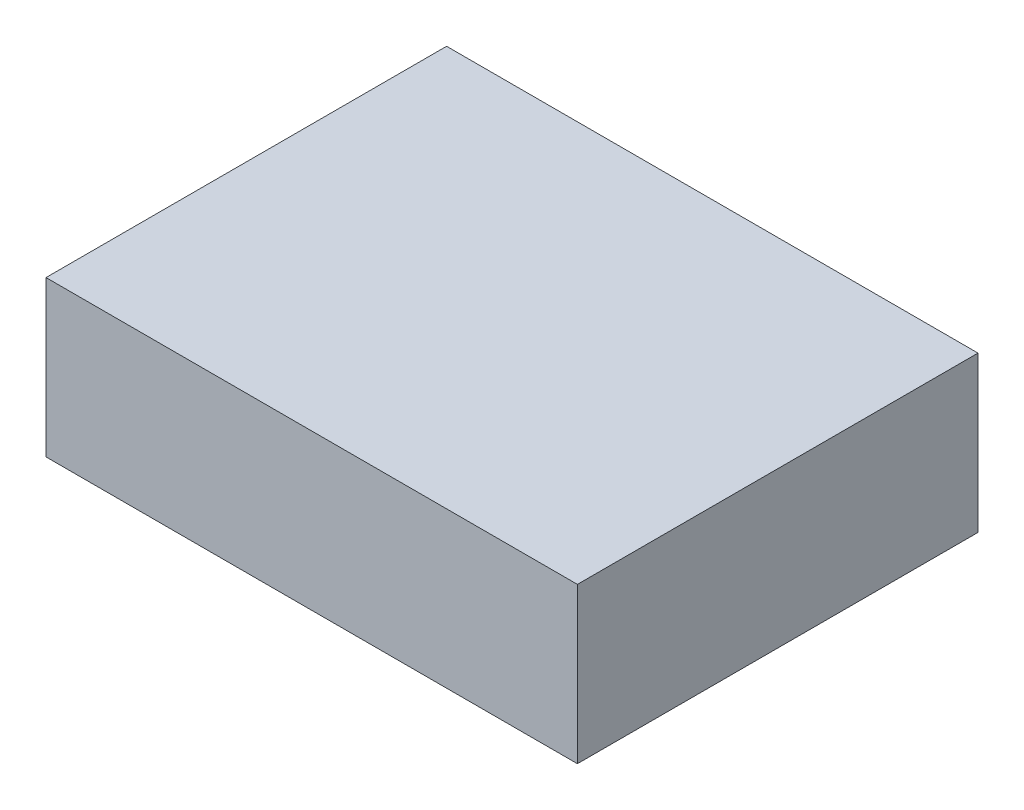
from build123d import *

# Parameters (mm, degrees)
SKETCH2_W           = 130
SKETCH2_H           = 98
BOSS_EXTRUDE1_DEPTH = 38


with BuildPart() as part:
    # Sketch2 → Boss-Extrude1 (new body)
    with BuildSketch(Plane(origin=(0, 0, 0), x_dir=(1, 0, 0), z_dir=(0, 1, 0))):
        Rectangle(SKETCH2_W, SKETCH2_H)
    extrude(amount=BOSS_EXTRUDE1_DEPTH)


solid = part.part
